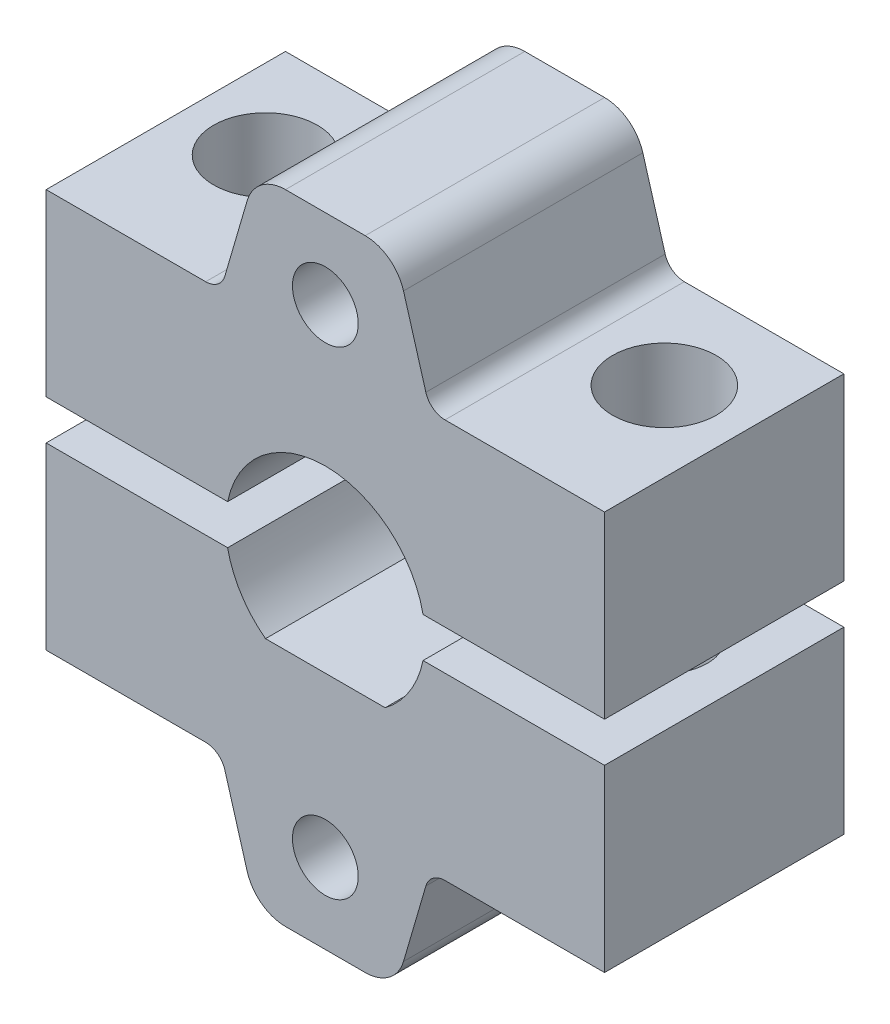
from build123d import *

# Parameters (mm, degrees)
SKETCH_1_R               = 1.65
EXTRUDE_1_DEPTH          = 12
EXTRUDE_1_2_DEPTH        = 12
CUT_EXTRUDE_2_DEPTH      = 32.874754901
CUT_EXTRUDE_2_DEPTH_BACK = 9
SKETCH_3_R               = 2.6
SKETCH_4_R               = 2.15
CUT_EXTRUDE_3_DEPTH      = 32.874754901


with BuildPart() as part:
    # 草图1 → 凸台-拉伸1 (new body)
    with BuildSketch(Plane.XY):
        with BuildLine():
            Line((-3, -4), (3, -4))
            ThreePointArc((3, -4), (4.224744871, -2.674234614), (4.898979486, -1))
            Line((4.898979486, -1), (14, -1))
            Line((14, -1), (14, -10))
            Line((14, -10), (6, -10))
            ThreePointArc((6, -10), (5.4, -10.2), (5.04, -10.72))
            Line((5.04, -10.72), (3.92, -14.56))
            ThreePointArc((3.92, -14.56), (3.2, -15.6), (2, -16))
            Line((2, -16), (-2, -16))
            ThreePointArc((-2, -16), (-3.2, -15.6), (-3.92, -14.56))
            Line((-3.92, -14.56), (-5.04, -10.72))
            ThreePointArc((-5.04, -10.72), (-5.4, -10.2), (-6, -10))
            Line((-6, -10), (-14, -10))
            Line((-14, -10), (-14, -1))
            Line((-14, -1), (-4.898979486, -1))
            ThreePointArc((-4.898979486, -1), (-4.224744871, -2.674234614), (-3, -4))
        make_face()
        with Locations((0, -12)):
            Circle(SKETCH_1_R, mode=Mode.SUBTRACT)
    extrude(amount=EXTRUDE_1_DEPTH)

    # 草图4 → 切除-拉伸3 (cut, through all)
    with BuildSketch(Plane(origin=(0, -10, 0), x_dir=(1, 0, 0), z_dir=(0, 1, 0))):
        with Locations((10, -5)):
            Circle(SKETCH_4_R)
        with Locations((-10, -5)):
            Circle(SKETCH_4_R)
    extrude(amount=CUT_EXTRUDE_3_DEPTH, mode=Mode.SUBTRACT)


with BuildPart() as body_2:
    # 草图1 → Extrude 1 2 (new body)
    with BuildSketch(Plane.XY):
        with BuildLine():
            Line((-3.92, 14.56), (-5.04, 10.72))
            ThreePointArc((-5.04, 10.72), (-5.4, 10.2), (-6, 10))
            Line((-6, 10), (-14, 10))
            Line((-14, 10), (-14, 1))
            Line((-14, 1), (-4.898979486, 1))
            ThreePointArc((-4.898979486, 1), (0, 5), (4.898979486, 1))
            Line((4.898979486, 1), (14, 1))
            Line((14, 1), (14, 10))
            Line((14, 10), (6, 10))
            ThreePointArc((6, 10), (5.4, 10.2), (5.04, 10.72))
            Line((5.04, 10.72), (3.92, 14.56))
            ThreePointArc((3.92, 14.56), (3.2, 15.6), (2, 16))
            Line((2, 16), (-2, 16))
            ThreePointArc((-2, 16), (-3.2, 15.6), (-3.92, 14.56))
        make_face()
        with Locations((0, 12)):
            Circle(SKETCH_1_R, mode=Mode.SUBTRACT)
    extrude(amount=EXTRUDE_1_2_DEPTH)

    # 草图3 → 切除-拉伸2 (cut, two sides: drawn at the far end of the back side and taken through both)
    with BuildSketch(Plane(origin=(0, 10, 0), x_dir=(1, 0, 0), z_dir=(0, 1, 0)).offset(-CUT_EXTRUDE_2_DEPTH_BACK)):
        with Locations(Location((10, -5, 0), (0, 0, 180))):
            Circle(SKETCH_3_R)
        with Locations(Location((-10, -5, 0), (0, 0, 90))):
            Circle(SKETCH_3_R)
    extrude(amount=CUT_EXTRUDE_2_DEPTH + CUT_EXTRUDE_2_DEPTH_BACK, mode=Mode.SUBTRACT)


solid = Compound([part.part, body_2.part])
